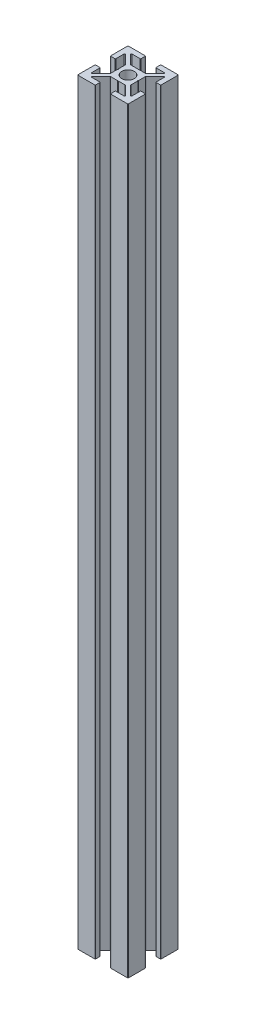
from build123d import *

# Parameters (mm, degrees)
SKETCH1_R           = 2.5
BOSS_EXTRUDE1_DEPTH = 300


with BuildPart() as part:
    # Sketch1 → Boss-Extrude1 (new body)
    with BuildSketch(Plane(origin=(0, 0, 0), x_dir=(1, 0, 0), z_dir=(0, 1, 0))):
        with BuildLine():
            Line((-2.997918472, 4.058578644), (-6.597918472, 7.658578644))
            ThreePointArc((-6.597918472, 7.658578644), (-6.621415508, 7.686854412), (-6.639339828, 7.718953455))
            ThreePointArc((-6.639339828, 7.718953455), (-6.656497116, 7.8), (-6.639339828, 7.881046545))
            ThreePointArc((-6.639339828, 7.881046545), (-6.565562901, 7.967644429), (-6.456497116, 8))
            Line((-6.456497116, 8), (-3.2, 8))
            ThreePointArc((-3.2, 8), (-3.058578644, 8.058578644), (-3, 8.2))
            Line((-3, 8.2), (-3, 9.8))
            ThreePointArc((-3, 9.8), (-3.058578644, 9.941421356), (-3.2, 10))
            Line((-3.2, 10), (-9.8, 10))
            ThreePointArc((-9.8, 10), (-9.941421356, 9.941421356), (-10, 9.8))
            Line((-10, 9.8), (-10, 3.2))
            ThreePointArc((-10, 3.2), (-9.941421356, 3.058578644), (-9.8, 3))
            Line((-9.8, 3), (-8.2, 3))
            ThreePointArc((-8.2, 3), (-8.058578644, 3.058578644), (-8, 3.2))
            Line((-8, 3.2), (-8, 6.456497116))
            ThreePointArc((-8, 6.456497116), (-7.967644429, 6.565562901), (-7.881046545, 6.639339828))
            ThreePointArc((-7.881046545, 6.639339828), (-7.8, 6.656497116), (-7.718953455, 6.639339828))
            ThreePointArc((-7.718953455, 6.639339828), (-7.686854412, 6.621415508), (-7.658578644, 6.597918472))
            Line((-7.658578644, 6.597918472), (-4.058578644, 2.997918472))
            ThreePointArc((-4.058578644, 2.997918472), (-4.015224093, 2.933033802), (-4, 2.856497116))
            Line((-4, 2.856497116), (-4, 0.130901699))
            ThreePointArc((-4, 0.130901699), (-3.99253254, 0.104615144), (-3.97236068, 0.08618034))
            Line((-3.97236068, 0.08618034), (-3.8, 0))
            Line((-3.8, 0), (-3.97236068, -0.08618034))
            ThreePointArc((-3.97236068, -0.08618034), (-3.99253254, -0.104615144), (-4, -0.130901699))
            Line((-4, -0.130901699), (-4, -2.856497116))
            ThreePointArc((-4, -2.856497116), (-4.015224093, -2.933033802), (-4.058578644, -2.997918472))
            Line((-4.058578644, -2.997918472), (-7.658578644, -6.597918472))
            ThreePointArc((-7.658578644, -6.597918472), (-7.686854412, -6.621415508), (-7.718953455, -6.639339828))
            ThreePointArc((-7.718953455, -6.639339828), (-7.8, -6.656497116), (-7.881046545, -6.639339828))
            ThreePointArc((-7.881046545, -6.639339828), (-7.967644429, -6.565562901), (-8, -6.456497116))
            Line((-8, -6.456497116), (-8, -3.2))
            ThreePointArc((-8, -3.2), (-8.058578644, -3.058578644), (-8.2, -3))
            Line((-8.2, -3), (-9.8, -3))
            ThreePointArc((-9.8, -3), (-9.941421356, -3.058578644), (-10, -3.2))
            Line((-10, -3.2), (-10, -9.8))
            ThreePointArc((-10, -9.8), (-9.941421356, -9.941421356), (-9.8, -10))
            Line((-9.8, -10), (-3.2, -10))
            ThreePointArc((-3.2, -10), (-3.058578644, -9.941421356), (-3, -9.8))
            Line((-3, -9.8), (-3, -8.2))
            ThreePointArc((-3, -8.2), (-3.058578644, -8.058578644), (-3.2, -8))
            Line((-3.2, -8), (-6.456497116, -8))
            ThreePointArc((-6.456497116, -8), (-6.565562901, -7.967644429), (-6.639339828, -7.881046545))
            ThreePointArc((-6.639339828, -7.881046545), (-6.656497116, -7.8), (-6.639339828, -7.718953455))
            ThreePointArc((-6.639339828, -7.718953455), (-6.621415508, -7.686854412), (-6.597918472, -7.658578644))
            Line((-6.597918472, -7.658578644), (-2.997918472, -4.058578644))
            ThreePointArc((-2.997918472, -4.058578644), (-2.933033802, -4.015224093), (-2.856497116, -4))
            Line((-2.856497116, -4), (-0.211803399, -4))
            ThreePointArc((-0.211803399, -4), (-0.200315753, -3.998662449), (-0.189442719, -3.99472136))
            Line((-0.189442719, -3.99472136), (0, -3.9))
            Line((0, -3.9), (0.189442719, -3.99472136))
            ThreePointArc((0.189442719, -3.99472136), (0.200315753, -3.998662449), (0.211803399, -4))
            Line((0.211803399, -4), (2.856497116, -4))
            ThreePointArc((2.856497116, -4), (2.933033802, -4.015224093), (2.997918472, -4.058578644))
            Line((2.997918472, -4.058578644), (6.597918472, -7.658578644))
            ThreePointArc((6.597918472, -7.658578644), (6.621415508, -7.686854412), (6.639339828, -7.718953455))
            ThreePointArc((6.639339828, -7.718953455), (6.656497116, -7.8), (6.639339828, -7.881046545))
            ThreePointArc((6.639339828, -7.881046545), (6.565562901, -7.967644429), (6.456497116, -8))
            Line((6.456497116, -8), (3.2, -8))
            ThreePointArc((3.2, -8), (3.058578644, -8.058578644), (3, -8.2))
            Line((3, -8.2), (3, -9.8))
            ThreePointArc((3, -9.8), (3.058578644, -9.941421356), (3.2, -10))
            Line((3.2, -10), (9.8, -10))
            ThreePointArc((9.8, -10), (9.941421356, -9.941421356), (10, -9.8))
            Line((10, -9.8), (10, -3.2))
            ThreePointArc((10, -3.2), (9.941421356, -3.058578644), (9.8, -3))
            Line((9.8, -3), (8.2, -3))
            ThreePointArc((8.2, -3), (8.058578644, -3.058578644), (8, -3.2))
            Line((8, -3.2), (8, -6.456497116))
            ThreePointArc((8, -6.456497116), (7.967644429, -6.565562901), (7.881046545, -6.639339828))
            ThreePointArc((7.881046545, -6.639339828), (7.8, -6.656497116), (7.718953455, -6.639339828))
            ThreePointArc((7.718953455, -6.639339828), (7.686854412, -6.621415508), (7.658578644, -6.597918472))
            Line((7.658578644, -6.597918472), (4.058578644, -2.997918472))
            ThreePointArc((4.058578644, -2.997918472), (4.015224093, -2.933033802), (4, -2.856497116))
            Line((4, -2.856497116), (4, -0.130901699))
            ThreePointArc((4, -0.130901699), (3.99253254, -0.104615144), (3.97236068, -0.08618034))
            Line((3.97236068, -0.08618034), (3.8, 0))
            Line((3.8, 0), (3.97236068, 0.08618034))
            ThreePointArc((3.97236068, 0.08618034), (3.99253254, 0.104615144), (4, 0.130901699))
            Line((4, 0.130901699), (4, 2.856497116))
            ThreePointArc((4, 2.856497116), (4.015224093, 2.933033802), (4.058578644, 2.997918472))
            Line((4.058578644, 2.997918472), (7.658578644, 6.597918472))
            ThreePointArc((7.658578644, 6.597918472), (7.686854412, 6.621415508), (7.718953455, 6.639339828))
            ThreePointArc((7.718953455, 6.639339828), (7.8, 6.656497116), (7.881046545, 6.639339828))
            ThreePointArc((7.881046545, 6.639339828), (7.967644429, 6.565562901), (8, 6.456497116))
            Line((8, 6.456497116), (8, 3.2))
            ThreePointArc((8, 3.2), (8.058578644, 3.058578644), (8.2, 3))
            Line((8.2, 3), (9.8, 3))
            ThreePointArc((9.8, 3), (9.941421356, 3.058578644), (10, 3.2))
            Line((10, 3.2), (10, 9.8))
            ThreePointArc((10, 9.8), (9.941421356, 9.941421356), (9.8, 10))
            Line((9.8, 10), (3.2, 10))
            ThreePointArc((3.2, 10), (3.058578644, 9.941421356), (3, 9.8))
            Line((3, 9.8), (3, 8.2))
            ThreePointArc((3, 8.2), (3.058578644, 8.058578644), (3.2, 8))
            Line((3.2, 8), (6.456497116, 8))
            ThreePointArc((6.456497116, 8), (6.565562901, 7.967644429), (6.639339828, 7.881046545))
            ThreePointArc((6.639339828, 7.881046545), (6.656497116, 7.8), (6.639339828, 7.718953455))
            ThreePointArc((6.639339828, 7.718953455), (6.621415508, 7.686854412), (6.597918472, 7.658578644))
            Line((6.597918472, 7.658578644), (2.997918472, 4.058578644))
            ThreePointArc((2.997918472, 4.058578644), (2.933033802, 4.015224093), (2.856497116, 4))
            Line((2.856497116, 4), (0.211803399, 4))
            ThreePointArc((0.211803399, 4), (0.200315753, 3.998662449), (0.189442719, 3.99472136))
            Line((0.189442719, 3.99472136), (0, 3.9))
            Line((0, 3.9), (-0.189442719, 3.99472136))
            ThreePointArc((-0.189442719, 3.99472136), (-0.200315753, 3.998662449), (-0.211803399, 4))
            Line((-0.211803399, 4), (-2.856497116, 4))
            ThreePointArc((-2.856497116, 4), (-2.933033802, 4.015224093), (-2.997918472, 4.058578644))
        make_face()
        Circle(SKETCH1_R, mode=Mode.SUBTRACT)
    extrude(amount=BOSS_EXTRUDE1_DEPTH)


solid = part.part
